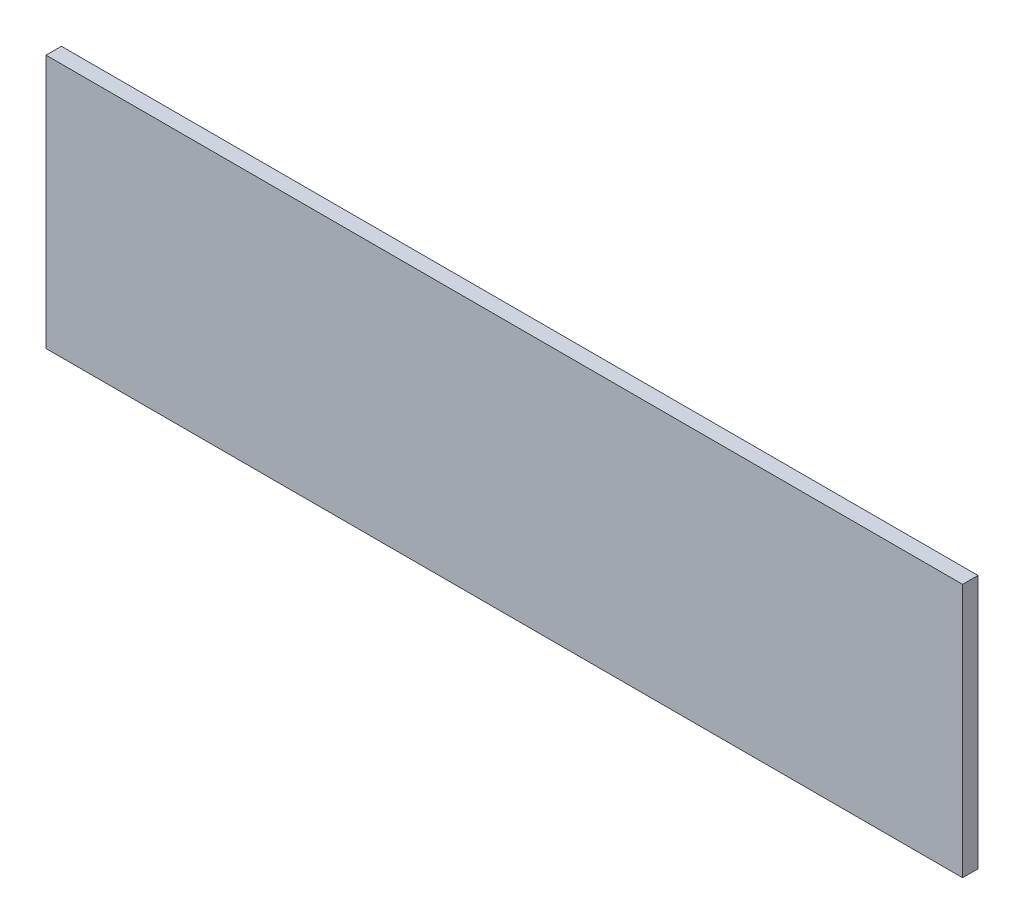
from build123d import *

# Parameters (mm, degrees)
ESQUISSE1_W        = 297.5
ESQUISSE1_H        = 82.47
BOSS_EXTRU_1_DEPTH = 5


with BuildPart() as part:
    # Esquisse1 → Boss.-Extru.1 (new body)
    with BuildSketch(Plane.XY):
        Rectangle(ESQUISSE1_W, ESQUISSE1_H)
    extrude(amount=BOSS_EXTRU_1_DEPTH)


solid = part.part
